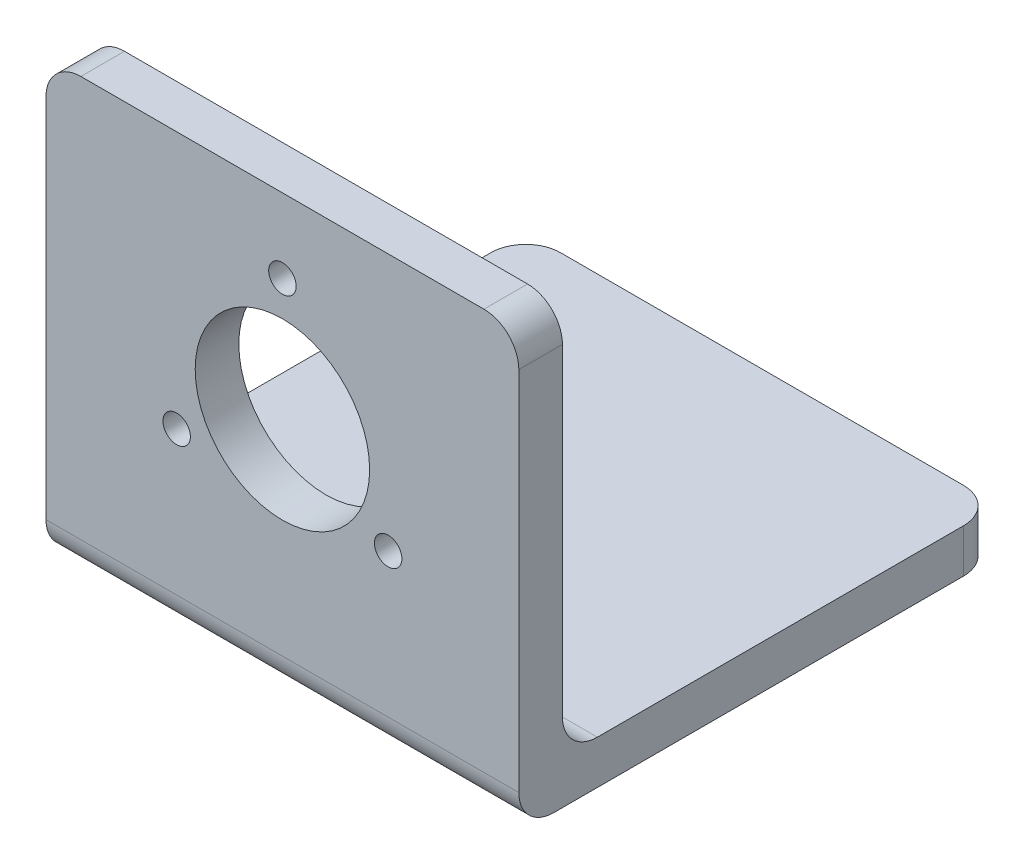
from build123d import *

# Parameters (mm, degrees)
SKETCH1_W                = 54.212076584
SKETCH1_H                = 45
SKETCH1_R                = 10
SKETCH1_R_2              = 1.575
BOSS_EXTRUDE1_DEPTH      = 5
BOSS_EXTRUDE2_DEPTH      = 50
BOSS_EXTRUDE2_DEPTH_BACK = 5
SKETCH2_W                = 54.212076584
SKETCH2_H                = 5
FILLET3_R                = 4


with BuildPart() as part:
    # Sketch1 → Boss-Extrude1 (new body)
    with BuildSketch(Plane.XY):
        Rectangle(SKETCH1_W, SKETCH1_H)
        Circle(SKETCH1_R, mode=Mode.SUBTRACT)
        with Locations((0, 14)):
            Circle(SKETCH1_R_2, mode=Mode.SUBTRACT)
        with Locations((12.124355653, -7)):
            Circle(SKETCH1_R_2, mode=Mode.SUBTRACT)
        with Locations((-12.124355653, -7)):
            Circle(SKETCH1_R_2, mode=Mode.SUBTRACT)
    extrude(amount=BOSS_EXTRUDE1_DEPTH)

    # Sketch2 → Boss-Extrude2 (add, two sides: drawn at the far end of the back side and taken through both)
    with BuildSketch(Plane(origin=(0, 0, 0), x_dir=(-1, 0, 0), z_dir=(0, 0, -1)).offset(-BOSS_EXTRUDE2_DEPTH_BACK)):
        with Locations((0, -25)):
            Rectangle(SKETCH2_W, SKETCH2_H)
    extrude(amount=BOSS_EXTRUDE2_DEPTH + BOSS_EXTRUDE2_DEPTH_BACK)

    # Fillet3
    fillet3_edges = [part.edges().sort_by_distance(p)[0] for p in [
        (0, -27.5, 5),
        (27.106038292, -25, -50),
        (-27.106038292, -25, -50),
        (0, -22.5, 0),
        (-27.106038292, 22.5, 2.5),
        (27.106038292, 22.5, 2.5),
    ]]
    fillet(fillet3_edges, radius=FILLET3_R)


solid = part.part
